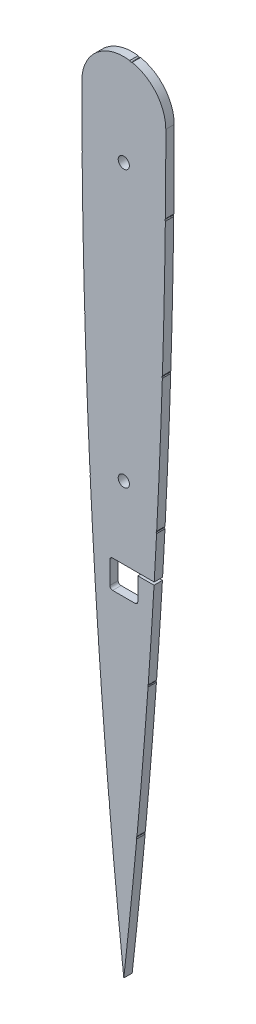
from build123d import *

# Parameters (mm, degrees)
BOSS_EXTRUDE1_DEPTH = 3
CUT_EXTRUDE2_DEPTH  = 10
SKETCH3_R           = 2
SKETCH3_W           = 26.546552511
SKETCH3_H           = 1
CUT_EXTRUDE1_DEPTH  = 10


with BuildPart() as part:
    # Sketch2 → Boss-Extrude1 (new body)
    with BuildSketch(Plane.XY):
        with BuildLine():
            ThreePointArc((0, -270), (11.247110938, -135.20817283), (15, 0))
            ThreePointArc((15, 0), (0, 15), (-15, 0))
            ThreePointArc((-15, 0), (-11.247110938, -135.20817283), (0, -270))
        make_face()
        with BuildLine():
            Line((-5, -143.105263158), (-5, -151.105263158))
            ThreePointArc((-5, -151.105263158), (-4.707106781, -151.812369939), (-4, -152.105263158))
            Line((-4, -152.105263158), (4, -152.105263158))
            ThreePointArc((4, -152.105263158), (4.707106781, -151.812369939), (5, -151.105263158))
            Line((5, -151.105263158), (5, -143.105263158))
            ThreePointArc((5, -143.105263158), (4.707106781, -142.398156377), (4, -142.105263158))
            Line((4, -142.105263158), (-4, -142.105263158))
            ThreePointArc((-4, -142.105263158), (-4.707106781, -142.398156377), (-5, -143.105263158))
        make_face(mode=Mode.SUBTRACT)
    extrude(amount=BOSS_EXTRUDE1_DEPTH)

    # Sketch5 → Cut-Extrude2 (cut)
    with BuildSketch(Plane.XY.offset(3)):
        with BuildLine():
            add(Edge.make_bspline(
                [(2.72730004, 15.824292406), (2.767869924, 15.816062694), (2.84715778, 15.799978937), (2.957065432, 15.747453985), (3.052806788, 15.673476721), (3.133916966, 15.581519392), (3.197769455, 15.476651752), (3.240583387, 15.362560437), (3.257599015, 15.240309362), (3.249425434, 15.158429237), (3.245230395, 15.116404785)],
                knots=[0, 0, 0, 0, 1.016789425, 1.987164947, 2.969481895, 3.979529776, 4.991120445, 5.978188561, 6.962318182, 8, 8, 8, 8], degree=3))
            add(Edge.make_bspline(
                [(3.245230395, 15.116404785), (3.236941967, 15.075855747), (3.220653515, 14.99616861), (3.168447797, 14.885241203), (3.094513927, 14.787916369), (3.002443038, 14.705685968), (2.898357916, 14.639199586), (2.783433814, 14.599926077), (2.663440087, 14.579485767), (2.582877601, 14.588130102), (2.541794898, 14.592538266)],
                knots=[0, 0, 0, 0, 1.017242216, 1.999088608, 2.991551492, 4.01018104, 5.02859166, 6.011950914, 6.986197761, 8, 8, 8, 8], degree=3))
            add(Edge.make_bspline(
                [(2.541794898, 14.592538266), (2.501167385, 14.600674145), (2.421117963, 14.616704476), (2.311780909, 14.67096984), (2.213766452, 14.743168465), (2.133904333, 14.837091234), (2.069711256, 14.942471196), (2.029129181, 15.057099383), (2.011343466, 15.177949927), (2.019617046, 15.258878636), (2.023864543, 15.300425886)],
                knots=[0, 0, 0, 0, 1.016778124, 2.003383769, 2.978329325, 3.997514719, 5.019537757, 6.002448377, 6.974495255, 8, 8, 8, 8], degree=3))
            add(Edge.make_bspline(
                [(2.023864543, 15.300425886), (2.032001555, 15.342020331), (2.047813702, 15.422848212), (2.100918475, 15.534013424), (2.172580902, 15.632181112), (2.265486244, 15.713399017), (2.370873395, 15.776069343), (2.484472624, 15.819945603), (2.605405289, 15.836561527), (2.68627411, 15.828421805), (2.72730004, 15.824292406)],
                knots=[0, 0, 0, 0, 1.038934563, 2.018896505, 3.002177293, 4.010735522, 5.03126259, 6.005465349, 6.988143544, 8, 8, 8, 8], degree=3))
        make_face()
        with BuildLine():
            add(Edge.make_bspline(
                [(15.941162477, -28.16516876), (15.938283446, -28.20646539), (15.932666171, -28.287039242), (15.897482546, -28.403192138), (15.838351559, -28.508587667), (15.758203779, -28.60073313), (15.664045957, -28.678593891), (15.556384856, -28.73444193), (15.438145001, -28.768466765), (15.355691752, -28.771876996), (15.313413078, -28.773625624)],
                knots=[0, 0, 0, 0, 1.019911447, 1.989949168, 2.968869643, 3.982543041, 4.989939763, 5.96802137, 6.958083956, 8, 8, 8, 8], degree=3))
            add(Edge.make_bspline(
                [(15.313413078, -28.773625624), (15.272027811, -28.771583703), (15.191086314, -28.767590103), (15.075778552, -28.728788584), (14.968175324, -28.672794989), (14.874404408, -28.592031897), (14.796633701, -28.496956765), (14.737819281, -28.390872567), (14.704437127, -28.274013883), (14.700849265, -28.193076872), (14.699020049, -28.15181239)],
                knots=[0, 0, 0, 0, 1.019613277, 1.994164368, 2.978865319, 4.002795445, 5.028330593, 6.002267793, 6.981487144, 8, 8, 8, 8], degree=3))
            add(Edge.make_bspline(
                [(14.699020049, -28.15181239), (14.70173967, -28.11046784), (14.707055547, -28.029654199), (14.744590322, -27.914046779), (14.803244535, -27.808444759), (14.88349036, -27.715601328), (14.97938427, -27.639116035), (15.085876254, -27.580971872), (15.203064511, -27.547241497), (15.284014373, -27.543684807), (15.325285407, -27.541871484)],
                knots=[0, 0, 0, 0, 1.022118704, 1.99787237, 2.978911391, 3.994778546, 5.013886585, 5.999802636, 6.980230322, 8, 8, 8, 8], degree=3))
            add(Edge.make_bspline(
                [(15.325285407, -27.541871484), (15.367578067, -27.544705168), (15.449633274, -27.550203013), (15.567654587, -27.585590834), (15.67442906, -27.644201954), (15.767243648, -27.725387677), (15.845376926, -27.819576096), (15.902013809, -27.926558896), (15.935854346, -28.042908559), (15.939370049, -28.123884453), (15.941162477, -28.16516876)],
                knots=[0, 0, 0, 0, 1.041997415, 2.021658435, 3.009176208, 4.020706237, 5.043123067, 6.008342245, 6.98458411, 8, 8, 8, 8], degree=3))
        make_face()
        with BuildLine():
            add(Edge.make_bspline(
                [(14.883870622, -77.282378997), (14.880726438, -77.32377051), (14.874608941, -77.404304093), (14.834840356, -77.519097938), (14.775562817, -77.624245631), (14.693193109, -77.715585455), (14.596380791, -77.791114533), (14.487476565, -77.845430594), (14.368886405, -77.878629178), (14.286517764, -77.879830893), (14.244248894, -77.880447573)],
                knots=[0, 0, 0, 0, 1.019529609, 1.98365236, 2.966868505, 3.977607639, 4.994800549, 5.976502888, 6.961608018, 8, 8, 8, 8], degree=3))
            add(Edge.make_bspline(
                [(14.244248894, -77.880447573), (14.20287977, -77.877234637), (14.121919989, -77.87094689), (14.006392743, -77.831822073), (13.900671271, -77.77176217), (13.808750118, -77.689910824), (13.730469987, -77.594763311), (13.677205158, -77.485838248), (13.64358421, -77.368986328), (13.642355258, -77.28805605), (13.641728194, -77.24676201)],
                knots=[0, 0, 0, 0, 1.021756415, 1.999587337, 2.984950973, 4.007072811, 5.024433924, 6.008280449, 6.983740682, 8, 8, 8, 8], degree=3))
            add(Edge.make_bspline(
                [(13.641728194, -77.24676201), (13.644994443, -77.205423973), (13.651386525, -77.124525031), (13.689696049, -77.008726586), (13.75232793, -76.905150467), (13.83370342, -76.813456892), (13.930742925, -76.738023409), (14.039191931, -76.684027134), (14.156187224, -76.650586884), (14.237097834, -76.649333144), (14.27838184, -76.648693433)],
                knots=[0, 0, 0, 0, 1.023230851, 2.002472822, 2.984845931, 3.999254394, 5.020140063, 6.005406318, 6.982274179, 8, 8, 8, 8], degree=3))
            add(Edge.make_bspline(
                [(14.27838184, -76.648693433), (14.320200617, -76.652010784), (14.402511006, -76.658540205), (14.519682935, -76.696206488), (14.625103146, -76.757954523), (14.716888519, -76.839151506), (14.795118572, -76.934397961), (14.848396326, -77.043297488), (14.882013909, -77.160156055), (14.883243323, -77.241085421), (14.883870622, -77.282378997)],
                knots=[0, 0, 0, 0, 1.030697566, 2.028684788, 3.00044426, 4.019408396, 5.033626516, 6.014433586, 6.986880272, 8, 8, 8, 8], degree=3))
        make_face()
        with BuildLine():
            add(Edge.make_bspline(
                [(12.818372813, -126.381995593), (12.814232196, -126.422937308), (12.806044872, -126.503892179), (12.762531401, -126.617737271), (12.698947282, -126.721303026), (12.614715955, -126.810561641), (12.515758841, -126.883397755), (12.405560927, -126.935223149), (12.285479078, -126.96274009), (12.203120626, -126.962419737), (12.160942591, -126.962255676)],
                knots=[0, 0, 0, 0, 1.009279047, 1.995667623, 2.969038993, 3.985785064, 4.996679311, 5.977413024, 6.964177438, 8, 8, 8, 8], degree=3))
            add(Edge.make_bspline(
                [(12.160942591, -126.962255676), (12.119983826, -126.958143812), (12.038995241, -126.950013342), (11.925640262, -126.906176575), (11.821015994, -126.844177312), (11.73114656, -126.760027108), (11.656248052, -126.66163733), (11.605581021, -126.551069883), (11.575284202, -126.433099083), (11.575911441, -126.351999798), (11.576230385, -126.310761619)],
                knots=[0, 0, 0, 0, 1.012262324, 2.001566516, 2.971452034, 4.000161911, 5.02130229, 6.004934903, 6.985529262, 8, 8, 8, 8], degree=3))
            add(Edge.make_bspline(
                [(11.576230385, -126.310761619), (11.581198771, -126.269928471), (11.590993684, -126.189428047), (11.63089875, -126.074441083), (11.698038112, -125.97325528), (11.781719188, -125.883177646), (11.8811913, -125.80960665), (11.991585508, -125.757837959), (12.110085052, -125.730061884), (12.19098271, -125.730353197), (12.232176566, -125.730501536)],
                knots=[0, 0, 0, 0, 1.014323954, 1.999686823, 2.972319061, 3.992292662, 5.023472702, 6.007319627, 6.985308231, 8, 8, 8, 8], degree=3))
            add(Edge.make_bspline(
                [(12.232176566, -125.730501536), (12.274104384, -125.734608219), (12.35651722, -125.742680268), (12.471999281, -125.78598682), (12.576004672, -125.849899237), (12.665091191, -125.934601798), (12.739273688, -126.032333419), (12.791294907, -126.141802466), (12.818771846, -126.259915177), (12.818507448, -126.340805482), (12.818372813, -126.381995593)],
                knots=[0, 0, 0, 0, 1.033961755, 2.032343313, 3.006257474, 4.023570525, 5.042269213, 6.012517435, 6.987955004, 8, 8, 8, 8], degree=3))
        make_face()
        with BuildLine():
            add(Edge.make_bspline(
                [(9.810793825, -175.398184744), (9.806653209, -175.439126459), (9.798465884, -175.52008133), (9.754952414, -175.633926422), (9.691368294, -175.737492177), (9.607136968, -175.826750792), (9.508179853, -175.899586906), (9.39798194, -175.9514123), (9.27790009, -175.978929241), (9.195541638, -175.978608888), (9.153363604, -175.978444827)],
                knots=[0, 0, 0, 0, 1.009279047, 1.995667623, 2.969038993, 3.985785064, 4.996679311, 5.977413024, 6.964177438, 8, 8, 8, 8], degree=3))
            add(Edge.make_bspline(
                [(9.153363604, -175.978444827), (9.112404838, -175.974332963), (9.031416253, -175.966202493), (8.918061274, -175.922365726), (8.813437006, -175.860366463), (8.723567572, -175.776216259), (8.648669064, -175.677826481), (8.598002034, -175.567259034), (8.567705215, -175.449288234), (8.568332453, -175.368188949), (8.568651398, -175.32695077)],
                knots=[0, 0, 0, 0, 1.012262324, 2.001566516, 2.971452034, 4.000161911, 5.02130229, 6.004934903, 6.985529262, 8, 8, 8, 8], degree=3))
            add(Edge.make_bspline(
                [(8.568651398, -175.32695077), (8.573619783, -175.286117622), (8.583414696, -175.205617198), (8.623319762, -175.090630234), (8.690459124, -174.989444431), (8.7741402, -174.899366797), (8.873612312, -174.825795801), (8.984006521, -174.77402711), (9.102506064, -174.746251035), (9.183403722, -174.746542348), (9.224597578, -174.746690687)],
                knots=[0, 0, 0, 0, 1.014323954, 1.999686823, 2.972319061, 3.992292662, 5.023472702, 6.007319627, 6.985308231, 8, 8, 8, 8], degree=3))
            add(Edge.make_bspline(
                [(9.224597578, -174.746690687), (9.266525396, -174.75079737), (9.348938232, -174.75886942), (9.464420293, -174.802175972), (9.568425684, -174.866088388), (9.657512203, -174.950790949), (9.7316947, -175.04852257), (9.783715919, -175.157991617), (9.811192859, -175.276104328), (9.81092846, -175.356994633), (9.810793825, -175.398184744)],
                knots=[0, 0, 0, 0, 1.033961755, 2.032343313, 3.006257474, 4.023570525, 5.042269213, 6.012517435, 6.987955004, 8, 8, 8, 8], degree=3))
        make_face()
        with BuildLine():
            add(Edge.make_bspline(
                [(5.730252838, -224.384097596), (5.724124479, -224.424643889), (5.712109406, -224.504137703), (5.663397618, -224.61464173), (5.596023976, -224.714862211), (5.506882074, -224.798919724), (5.406054437, -224.868524559), (5.292478781, -224.911212819), (5.172717208, -224.935922378), (5.090725525, -224.930175679), (5.049077958, -224.927256651)],
                knots=[0, 0, 0, 0, 1.011468771, 1.98305456, 2.961643276, 3.983959405, 4.999869658, 5.973538494, 6.970661583, 8, 8, 8, 8], degree=3))
            add(Edge.make_bspline(
                [(5.049077958, -224.927256651), (5.008011817, -224.921204549), (4.927962114, -224.909407265), (4.816805077, -224.86000582), (4.71594696, -224.793581925), (4.63090269, -224.704880089), (4.560404489, -224.604632932), (4.516077822, -224.492170938), (4.491656441, -224.373712472), (4.496184708, -224.293173931), (4.498498698, -224.252017935)],
                knots=[0, 0, 0, 0, 1.024996874, 1.998013257, 2.988203646, 4.003239904, 5.027502277, 6.007147858, 6.981632712, 8, 8, 8, 8], degree=3))
            add(Edge.make_bspline(
                [(4.498498698, -224.252017935), (4.505184541, -224.210984821), (4.518202219, -224.131091252), (4.566805463, -224.020009703), (4.633836388, -223.919913655), (4.723926959, -223.836444535), (4.826124236, -223.768876433), (4.937854368, -223.720718534), (5.057763287, -223.699807278), (5.138578847, -223.703840105), (5.179673578, -223.705890798)],
                knots=[0, 0, 0, 0, 1.026077836, 1.997825957, 2.976578176, 3.99058755, 5.016884829, 5.999922457, 6.982960084, 8, 8, 8, 8], degree=3))
            add(Edge.make_bspline(
                [(5.179673578, -223.705890798), (5.221149445, -223.712676328), (5.302354034, -223.72596155), (5.415552659, -223.773314502), (5.516287284, -223.841733627), (5.600621287, -223.930642788), (5.669230728, -224.031616213), (5.714688124, -224.143219272), (5.738783363, -224.261989139), (5.73312649, -224.342963298), (5.730252838, -224.384097596)],
                knots=[0, 0, 0, 0, 1.035582176, 2.027541132, 3.003939876, 4.023968176, 5.037604936, 6.002304329, 6.985184764, 8, 8, 8, 8], degree=3))
        make_face()
        with BuildLine():
            add(Edge.make_bspline(
                [(-1.43740375, -266.997724618), (-1.440362965, -266.956567098), (-1.446153263, -266.876034148), (-1.421177451, -266.7582497), (-1.378265107, -266.646389735), (-1.309182071, -266.54571516), (-1.224506355, -266.45697972), (-1.124996541, -266.387123825), (-1.012047349, -266.339387284), (-0.931277362, -266.326260138), (-0.889792572, -266.31951782)],
                knots=[0, 0, 0, 0, 1.017477596, 1.990899197, 2.953537855, 3.969833882, 4.992538218, 5.978454344, 6.961700983, 8, 8, 8, 8], degree=3))
            add(Edge.make_bspline(
                [(-0.889792572, -266.31951782), (-0.848680634, -266.31742658), (-0.767831237, -266.313314015), (-0.648356884, -266.334774348), (-0.535838473, -266.380572044), (-0.433962546, -266.449136919), (-0.34262648, -266.531946028), (-0.273775084, -266.631724404), (-0.225667668, -266.74283758), (-0.212416462, -266.822166713), (-0.20564961, -266.862676875)],
                knots=[0, 0, 0, 0, 1.0171405, 2.000275349, 2.978740789, 4.005139567, 5.02816805, 6.013972083, 6.98581631, 8, 8, 8, 8], degree=3))
            add(Edge.make_bspline(
                [(-0.20564961, -266.862676875), (-0.203378745, -266.903826797), (-0.198907997, -266.984840389), (-0.222997581, -267.103856269), (-0.267512169, -267.216827377), (-0.338498324, -267.317100761), (-0.42243192, -267.406711029), (-0.522734603, -267.474004408), (-0.633659524, -267.522980367), (-0.713689042, -267.534813288), (-0.754744829, -267.540883672)],
                knots=[0, 0, 0, 0, 1.017010222, 2.002230987, 2.980571102, 4.003468552, 5.025925636, 6.004649277, 6.976369027, 8, 8, 8, 8], degree=3))
            add(Edge.make_bspline(
                [(-0.754744829, -267.540883672), (-0.796357518, -267.543627516), (-0.878192216, -267.549023504), (-0.998366039, -267.526867699), (-1.11191318, -267.483085087), (-1.213891225, -267.414588253), (-1.303136785, -267.329904136), (-1.370548932, -267.229769417), (-1.41949397, -267.118800766), (-1.43133117, -267.0387773), (-1.43740375, -266.997724618)],
                knots=[0, 0, 0, 0, 1.026764845, 2.019215594, 2.990450044, 4.014010338, 5.033770452, 6.009912482, 6.979069093, 8, 8, 8, 8], degree=3))
        make_face()
        with BuildLine():
            add(Edge.make_bspline(
                [(-6.332452723, -218.100484936), (-6.334309868, -218.058806867), (-6.337927412, -217.977621899), (-6.311813186, -217.858748128), (-6.266350742, -217.746538129), (-6.193571176, -217.646869437), (-6.106633314, -217.559784652), (-6.004221578, -217.492634065), (-5.889663828, -217.446476922), (-5.80751439, -217.435371474), (-5.76554901, -217.429698344)],
                knots=[0, 0, 0, 0, 1.020609653, 1.988051825, 2.962866683, 3.974176738, 4.996592845, 5.970498644, 6.963245567, 8, 8, 8, 8], degree=3))
            add(Edge.make_bspline(
                [(-5.76554901, -217.429698344), (-5.723889821, -217.427884275), (-5.642741629, -217.424350637), (-5.523411029, -217.449900129), (-5.411683271, -217.497976726), (-5.310890729, -217.569831921), (-5.222135588, -217.655422814), (-5.153068991, -217.7559297), (-5.107388703, -217.86907483), (-5.096062515, -217.949712516), (-5.090310295, -217.990665893)],
                knots=[0, 0, 0, 0, 1.023659603, 1.99399284, 2.97649374, 4.000805978, 5.026277434, 5.999743127, 6.984131639, 8, 8, 8, 8], degree=3))
            add(Edge.make_bspline(
                [(-5.090310295, -217.990665893), (-5.0883282, -218.032359054), (-5.084462381, -218.113676142), (-5.112444644, -218.232625973), (-5.160039551, -218.344459235), (-5.231525973, -218.445720169), (-5.319219425, -218.53270078), (-5.420819611, -218.599995625), (-5.534418248, -218.644087296), (-5.614810159, -218.655595011), (-5.655729967, -218.661452484)],
                knots=[0, 0, 0, 0, 1.023478968, 1.996162573, 2.978490102, 4.002621591, 5.027912091, 6.004555903, 6.984310899, 8, 8, 8, 8], degree=3))
            add(Edge.make_bspline(
                [(-5.655729967, -218.661452484), (-5.697893124, -218.663261838), (-5.780525132, -218.666807836), (-5.901436397, -218.641076138), (-6.015552555, -218.595387802), (-6.116105388, -218.523022603), (-6.204187196, -218.437003775), (-6.270919425, -218.335315651), (-6.31510749, -218.221817447), (-6.326601981, -218.141411757), (-6.332452723, -218.100484936)],
                knots=[0, 0, 0, 0, 1.031617807, 2.021780504, 3.006722755, 4.026853854, 5.039521451, 6.012350365, 6.988278312, 8, 8, 8, 8], degree=3))
        make_face()
        with BuildLine():
            add(Edge.make_bspline(
                [(-10.23325016, -169.12875484), (-10.233826611, -169.087596769), (-10.234964131, -169.006379019), (-10.209517103, -168.887623809), (-10.158322613, -168.777451119), (-10.086005897, -168.678598118), (-9.998058755, -168.591465253), (-9.89379067, -168.52734396), (-9.778304651, -168.483600498), (-9.696409792, -168.474500426), (-9.654474118, -168.469840577)],
                knots=[0, 0, 0, 0, 1.010031034, 1.993107205, 2.956643819, 3.976299969, 4.99151949, 5.980599236, 6.965931034, 8, 8, 8, 8], degree=3))
            add(Edge.make_bspline(
                [(-9.654474118, -168.469840577), (-9.613305654, -168.469242369), (-9.532067396, -168.468061918), (-9.413017695, -168.493918747), (-9.301913364, -168.544254306), (-9.20278954, -168.617567998), (-9.115035133, -168.704107149), (-9.050082626, -168.806838276), (-9.004710481, -168.919529634), (-8.995690048, -169.000210901), (-8.991107732, -169.041196413)],
                knots=[0, 0, 0, 0, 1.014102888, 2.001142248, 2.979680341, 4.003447148, 5.03128635, 6.003706608, 6.985897112, 8, 8, 8, 8], degree=3))
            add(Edge.make_bspline(
                [(-8.991107732, -169.041196413), (-8.990340871, -169.082404222), (-8.988825616, -169.163827464), (-9.017185941, -169.282410003), (-9.066780031, -169.394177435), (-9.141544168, -169.492856123), (-9.229769691, -169.578892967), (-9.333278327, -169.642855334), (-9.446313484, -169.687799494), (-9.527428101, -169.696965098), (-9.568399732, -169.701594717)],
                knots=[0, 0, 0, 0, 1.012207517, 2.000038821, 2.976748014, 4.005776446, 5.031984329, 5.996056693, 6.987792483, 8, 8, 8, 8], degree=3))
            add(Edge.make_bspline(
                [(-9.568399732, -169.701594717), (-9.610570009, -169.702274919), (-9.692819935, -169.7036016), (-9.813176632, -169.677213068), (-9.925098694, -169.627586774), (-10.02434871, -169.55419797), (-10.111516346, -169.467105135), (-10.173640762, -169.362916518), (-10.219797256, -169.250510532), (-10.228718322, -169.169770303), (-10.23325016, -169.12875484)],
                knots=[0, 0, 0, 0, 1.034533552, 2.017779259, 3.003656482, 4.023488476, 5.038883076, 6.011379296, 6.989794782, 8, 8, 8, 8], degree=3))
        make_face()
        with BuildLine():
            add(Edge.make_bspline(
                [(-13.144110994, -120.084853552), (-13.144415975, -120.043620033), (-13.145015752, -119.962529914), (-13.115031564, -119.84493029), (-13.06407231, -119.735344514), (-12.988687438, -119.638469523), (-12.899140613, -119.553984963), (-12.793394111, -119.49217918), (-12.67768039, -119.449917908), (-12.59538327, -119.442880424), (-12.553462624, -119.439295659)],
                knots=[0, 0, 0, 0, 1.011998657, 1.990203485, 2.960407282, 3.969320345, 4.995523442, 5.973500578, 6.9677383, 8, 8, 8, 8], degree=3))
            add(Edge.make_bspline(
                [(-12.553462624, -119.439295659), (-12.512241428, -119.439012954), (-12.431175544, -119.438456985), (-12.312753269, -119.468284597), (-12.202954147, -119.521102561), (-12.104530388, -119.595498463), (-12.019985985, -119.684675923), (-11.955956338, -119.787969342), (-11.914722669, -119.902437408), (-11.906258234, -119.983119304), (-11.901968566, -120.024007865)],
                knots=[0, 0, 0, 0, 1.014665095, 1.99544732, 2.984488432, 4.005824445, 5.025771234, 6.002206776, 6.987543742, 8, 8, 8, 8], degree=3))
            add(Edge.make_bspline(
                [(-11.901968566, -120.024007865), (-11.902329545, -120.06521691), (-11.90303927, -120.146238703), (-11.932050406, -120.264360082), (-11.985675767, -120.373706858), (-12.060825566, -120.471408142), (-12.15190824, -120.554834907), (-12.256344809, -120.616101855), (-12.370349437, -120.658870756), (-12.451177387, -120.666922013), (-12.492616937, -120.671049799)],
                knots=[0, 0, 0, 0, 1.014887742, 1.995387806, 2.973145633, 4.001539039, 5.021923595, 6.002195433, 6.975748817, 8, 8, 8, 8], degree=3))
            add(Edge.make_bspline(
                [(-12.492616937, -120.671049799), (-12.534831928, -120.670758196), (-12.617356212, -120.670188153), (-12.736986911, -120.640636864), (-12.847850174, -120.589416116), (-12.946409586, -120.515164872), (-13.028803793, -120.424202513), (-13.091352981, -120.320522732), (-13.133263578, -120.206571905), (-13.140464618, -120.125769374), (-13.144110994, -120.084853552)],
                knots=[0, 0, 0, 0, 1.036444828, 2.026101769, 3.006950208, 4.025200246, 5.042794454, 6.009934709, 6.992294472, 8, 8, 8, 8], degree=3))
        make_face()
        with BuildLine():
            add(Edge.make_bspline(
                [(-15.069786462, -70.994376789), (-15.069189322, -70.95307016), (-15.068019013, -70.872115211), (-15.034032398, -70.75565506), (-14.982683612, -70.646498068), (-14.905728603, -70.550797303), (-14.813742512, -70.469467033), (-14.707733864, -70.408944218), (-14.591016222, -70.370250181), (-14.509115575, -70.363923864), (-14.467265762, -70.360691225)],
                knots=[0, 0, 0, 0, 1.014894553, 1.989044811, 2.966172611, 3.974587794, 4.995336993, 5.979377355, 6.967496815, 8, 8, 8, 8], degree=3))
            add(Edge.make_bspline(
                [(-14.467265762, -70.360691225), (-14.425993867, -70.361385541), (-14.344627915, -70.362754359), (-14.227016942, -70.395726051), (-14.118065878, -70.449976008), (-14.021166828, -70.525939485), (-13.938104684, -70.616606968), (-13.876054226, -70.720422948), (-13.837054504, -70.835431265), (-13.83083873, -70.91591161), (-13.827644034, -70.95727576)],
                knots=[0, 0, 0, 0, 1.016663692, 2.004313273, 2.988551275, 4.008371516, 5.029876142, 6.011224017, 6.977837024, 8, 8, 8, 8], degree=3))
            add(Edge.make_bspline(
                [(-13.827644034, -70.95727576), (-13.828313703, -70.99854615), (-13.829626157, -71.079430073), (-13.8626997, -71.196837553), (-13.918649181, -71.304983059), (-13.9954483, -71.401972195), (-14.087969772, -71.483185747), (-14.192548265, -71.544230685), (-14.307880698, -71.58287302), (-14.388810784, -71.589208195), (-14.430164734, -71.592445365)],
                knots=[0, 0, 0, 0, 1.015687287, 1.990598454, 2.97941429, 4.005769472, 5.027315978, 6.001538189, 6.97881871, 8, 8, 8, 8], degree=3))
            add(Edge.make_bspline(
                [(-14.430164734, -71.592445365), (-14.472433604, -71.591828685), (-14.554802245, -71.59062697), (-14.673392405, -71.557428386), (-14.782296631, -71.503112325), (-14.879108949, -71.427583247), (-14.961478657, -71.336243423), (-15.020756196, -71.23109573), (-15.060524782, -71.116301885), (-15.066642278, -71.035768302), (-15.069786462, -70.994376789)],
                knots=[0, 0, 0, 0, 1.038391982, 2.023497112, 3.005199451, 4.022392361, 5.033131495, 6.01634764, 6.980470391, 8, 8, 8, 8], degree=3))
        make_face()
        with BuildLine():
            add(Edge.make_bspline(
                [(-16.003534296, -21.871388531), (-16.001740044, -21.830106214), (-15.998220761, -21.749134223), (-15.964406178, -21.632756262), (-15.907998947, -21.526499435), (-15.830632193, -21.432019889), (-15.736877187, -21.352360382), (-15.630084055, -21.29331436), (-15.512071832, -21.257571352), (-15.429956821, -21.253273351), (-15.387657226, -21.251059338)],
                knots=[0, 0, 0, 0, 1.016569257, 1.993919991, 2.96023552, 3.966643983, 4.988620173, 5.977259624, 6.958033398, 8, 8, 8, 8], degree=3))
            add(Edge.make_bspline(
                [(-15.387657226, -21.251059338), (-15.346362553, -21.252830447), (-15.265366327, -21.256304338), (-15.148739893, -21.29057272), (-15.040854918, -21.346377921), (-14.94625042, -21.424937402), (-14.865946372, -21.517989866), (-14.804760706, -21.622528808), (-14.769988846, -21.739185906), (-14.764305011, -21.819722638), (-14.761391868, -21.861000243)],
                knots=[0, 0, 0, 0, 1.019212314, 1.999104139, 2.978766741, 4.00500617, 5.020318094, 6.00683423, 6.978439943, 8, 8, 8, 8], degree=3))
            add(Edge.make_bspline(
                [(-14.761391868, -21.861000243), (-14.763063086, -21.902308584), (-14.766346675, -21.983470714), (-14.802074385, -22.099831165), (-14.860450279, -22.206042278), (-14.937701359, -22.30152668), (-15.032801745, -22.379405605), (-15.137634874, -22.439280818), (-15.253947855, -22.474278285), (-15.334499598, -22.479921271), (-15.375784897, -22.482813478)],
                knots=[0, 0, 0, 0, 1.019998264, 2.004080303, 2.979437902, 4.0064687, 5.024038306, 6.005297231, 6.977652183, 8, 8, 8, 8], degree=3))
            add(Edge.make_bspline(
                [(-15.375784897, -22.482813478), (-15.418038138, -22.4810204), (-15.500441787, -22.47752348), (-15.61926284, -22.444058238), (-15.726098644, -22.385502258), (-15.822453172, -22.309000471), (-15.902141803, -22.215288253), (-15.959097714, -22.108756688), (-15.997430172, -21.993675681), (-16.001469165, -21.912760396), (-16.003534296, -21.871388531)],
                knots=[0, 0, 0, 0, 1.039188271, 2.026658838, 3.007870221, 4.022115205, 5.042416744, 6.012902521, 6.984000013, 8, 8, 8, 8], degree=3))
        make_face()
    extrude(amount=-CUT_EXTRUDE2_DEPTH, mode=Mode.SUBTRACT)

    # Sketch3 → Cut-Extrude1 (cut)
    with BuildSketch(Plane.XY.offset(3)):
        with Locations((0, -17.794863927)):
            Circle(SKETCH3_R)
        with Locations((0, -116.273442089)):
            Circle(SKETCH3_R)
        with Locations((13.364951442, -142.605263158)):
            Rectangle(SKETCH3_W, SKETCH3_H)
    extrude(amount=-CUT_EXTRUDE1_DEPTH, mode=Mode.SUBTRACT)


solid = part.part
